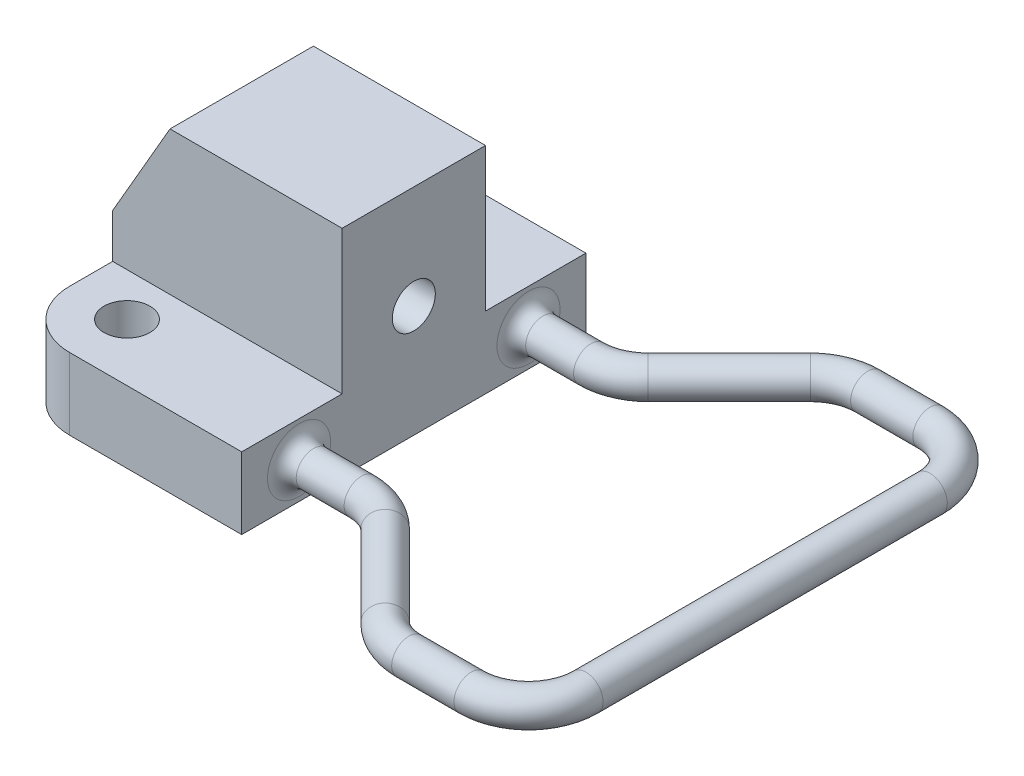
from build123d import *

# Parameters (mm, degrees)
SKETCH_1_R        = 8
EXTRUDE_1_DEPTH   = 25
EXTRUDE_2_DEPTH   = 25
SKETCH_11_R       = 7.5
SWEEP_1_PROFILE_R = 6
FILLET_1_R        = 5


with BuildPart() as part:
    # 草图1 → 凸台-拉伸1 (new body)
    with BuildSketch(Plane(origin=(0, 0, 0), x_dir=(1, 0, 0), z_dir=(0, 1, 0))):
        with BuildLine():
            Line((-20, 60), (40, 60))
            Line((40, 60), (40, -60))
            Line((40, -60), (-20, -60))
            ThreePointArc((-20, -60), (-34.142135624, -54.142135624), (-40, -40))
            Line((-40, -40), (-40, 40))
            ThreePointArc((-40, 40), (-34.142135624, 54.142135624), (-20, 60))
        make_face()
        with Locations(Location((-20, -40, 0), (0, 0, 270))):
            Circle(SKETCH_1_R, mode=Mode.SUBTRACT)
        with Locations(Location((-20, 40, 0), (0, 0, 270))):
            Circle(SKETCH_1_R, mode=Mode.SUBTRACT)
    extrude(amount=EXTRUDE_1_DEPTH)

    # 草图2 → 凸台-拉伸2 (add, symmetric)
    with BuildSketch(Plane.XY):
        Polygon((40, 25), (-40, 25), (-40, 40.358983849), (-20, 75), (40, 75), align=None)
    extrude(amount=EXTRUDE_2_DEPTH, both=True)

    # 切除-扫描2: sweep along a path in 草图4
    with BuildLine(Plane.XY) as sweep_2_path:
        Line((-30, 57.679491924), (-14.192519241, 48.553038653))
        Line((-14.192519241, 48.553038653), (-4.607695155, 43.019237886))
        ThreePointArc((-4.607695155, 43.019237886), (2.627733492, 40.022225211), (10.392304845, 39))
        Line((10.392304845, 39), (21.338264313, 39))
        Line((21.338264313, 39), (40, 39))
    # 草图11 → 切除-扫描2 (sweep, cut)
    with BuildSketch(Plane(origin=(-47.475952642, 27.410254038, 0), x_dir=(0, 0, 1), z_dir=(-0.8660254037844382, 0.5000000000000011, 0))):
        with Locations((0, 34.951905284)):
            Circle(SKETCH_11_R)
    sweep(path=sweep_2_path.line, mode=Mode.SUBTRACT)

    # 扫描1: sweep along a path in 草图13
    with BuildLine(Plane.ZX.offset(12.5)) as sweep_1_path:
        Line((-40, 40), (-40, 61.715728753))
        ThreePointArc((-40, 61.715728753), (-41.52240935, 69.3693974), (-45.857864376, 75.857864376))
        Line((-45.857864376, 75.857864376), (-74.142135624, 104.142135624))
        ThreePointArc((-74.142135624, 104.142135624), (-78.47759065, 110.6306026), (-80, 118.284271247))
        Line((-80, 118.284271247), (-80, 140))
        ThreePointArc((-80, 140), (-74.142135624, 154.142135624), (-60, 160))
        Line((-60, 160), (60, 160))
        ThreePointArc((60, 160), (74.142135624, 154.142135624), (80, 140))
        Line((80, 140), (80, 118.284271247))
        ThreePointArc((80, 118.284271247), (78.47759065, 110.6306026), (74.142135624, 104.142135624))
        Line((74.142135624, 104.142135624), (45.857864376, 75.857864376))
        ThreePointArc((45.857864376, 75.857864376), (41.52240935, 69.3693974), (40, 61.715728753))
        Line((40, 61.715728753), (40, 40))
    # 扫描1 profile (on start of the path) → 扫描1 (sweep)
    with BuildSketch(Plane(origin=(40, 12.5, -40), x_dir=(0, 0, 1), z_dir=(1, 0, 0))):
        Circle(SWEEP_1_PROFILE_R)
    sweep(path=sweep_1_path.line)

    # 圆角1
    fillet_1_edges = [part.edges().sort_by_distance(p)[0] for p in [
        (40, 12.5, 46),
        (40, 12.5, -46),
    ]]
    fillet(fillet_1_edges, radius=FILLET_1_R)


solid = part.part
